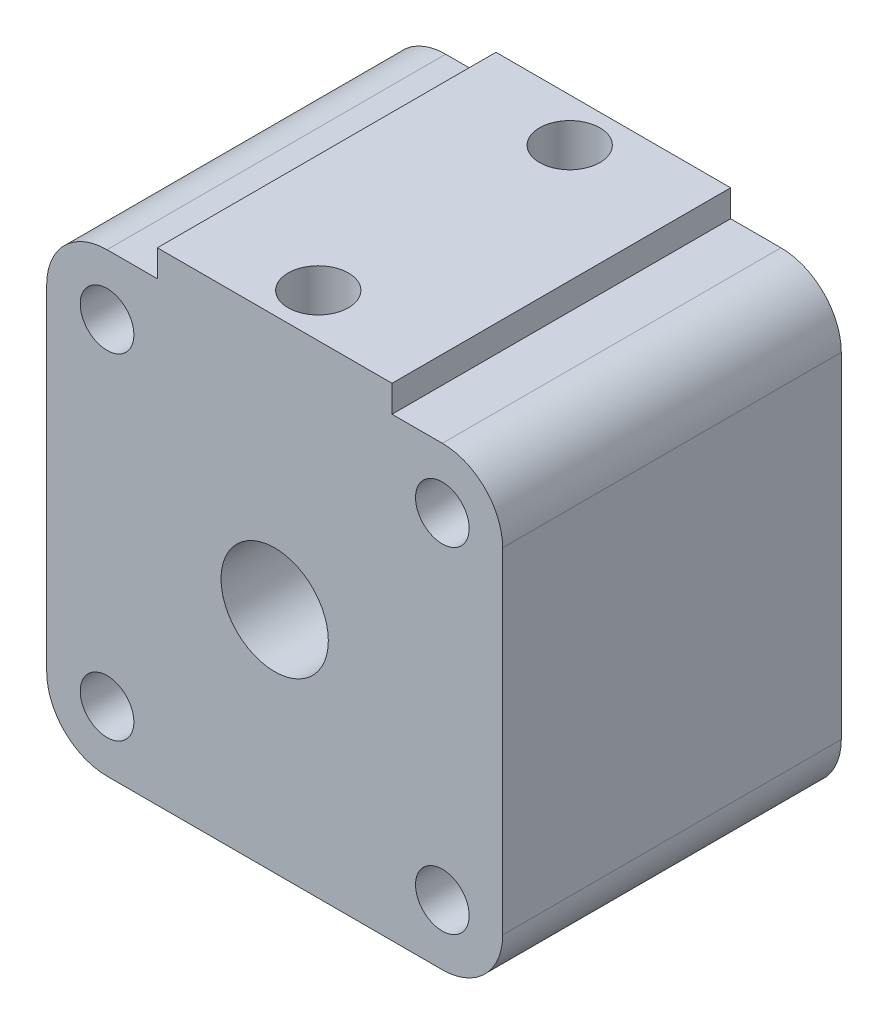
from build123d import *

# Parameters (mm, degrees)
SALIENTE_EXTRUIR1_DEPTH = 50.5
CROQUIS2_R              = 4
CORTAR_EXTRUIR1_DEPTH   = 20
CROQUIS3_R              = 8
CORTAR_EXTRUIR2_DEPTH   = 20
CROQUIS4_R              = 4.5
CORTAR_EXTRUIR3_DEPTH   = 10


with BuildPart() as part:
    # Croquis1 → Saliente-Extruir1 (new body)
    with BuildSketch(Plane.XY):
        with BuildLine():
            Line((-17.5, 34), (-17.5, 38))
            Line((-17.5, 38), (17.5, 38))
            Line((17.5, 38), (17.5, 34))
            Line((17.5, 34), (25, 34))
            ThreePointArc((25, 34), (31.363961031, 31.363961031), (34, 25))
            Line((34, 25), (34, -25))
            ThreePointArc((34, -25), (31.363961031, -31.363961031), (25, -34))
            Line((25, -34), (-25, -34))
            ThreePointArc((-25, -34), (-31.363961031, -31.363961031), (-34, -25))
            Line((-34, -25), (-34, 25))
            ThreePointArc((-34, 25), (-31.363961031, 31.363961031), (-25, 34))
            Line((-25, 34), (-17.5, 34))
        make_face()
    extrude(amount=-SALIENTE_EXTRUIR1_DEPTH)

    # Croquis2 → Cortar-Extruir1 (cut)
    with BuildSketch(Plane.XY):
        with Locations((-25, 25)):
            Circle(CROQUIS2_R)
        with Locations((-25, -25)):
            Circle(CROQUIS2_R)
        with Locations((25, -25)):
            Circle(CROQUIS2_R)
        with Locations((25, 25)):
            Circle(CROQUIS2_R)
    extrude(amount=-CORTAR_EXTRUIR1_DEPTH, mode=Mode.SUBTRACT)

    # Croquis3 → Cortar-Extruir2 (cut)
    with BuildSketch(Plane.XY):
        Circle(CROQUIS3_R)
    extrude(amount=-CORTAR_EXTRUIR2_DEPTH, mode=Mode.SUBTRACT)

    # Croquis4 → Cortar-Extruir3 (cut)
    with BuildSketch(Plane(origin=(0, 38, 0), x_dir=(1, 0, 0), z_dir=(0, 1, 0))):
        with Locations(Location((0, 6.5, 0), (0, 0, 270))):
            Circle(CROQUIS4_R)
        with Locations(Location((0, 44, 0), (0, 0, 270))):
            Circle(CROQUIS4_R)
    extrude(amount=-CORTAR_EXTRUIR3_DEPTH, mode=Mode.SUBTRACT)


solid = part.part
